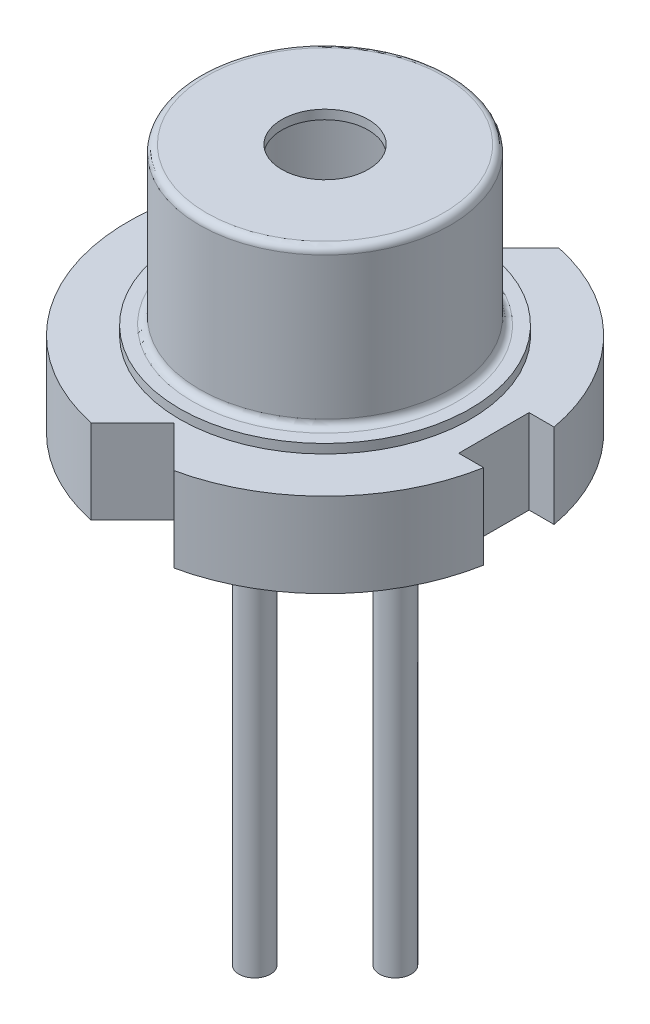
from build123d import *

# Parameters (mm, degrees)
SKETCH1_R           = 2.8
BOSS_EXTRUDE1_DEPTH = 1.2
SKETCH2_R           = 2.065
BOSS_EXTRUDE2_DEPTH = 0.13
SKETCH3_R           = 1.785
BOSS_EXTRUDE3_DEPTH = 2.22
SKETCH4_R           = 0.615
CUT_EXTRUDE1_DEPTH  = 1
SKETCH5_R           = 0.4
BOSS_EXTRUDE4_DEPTH = 0.05
SKETCH6_W           = 0.4
SKETCH6_H           = 1
CUT_EXTRUDE2_DEPTH  = 6.31812937
SKETCH7_R           = 0.6
BOSS_EXTRUDE5_DEPTH = 0.4
SKETCH8_R           = 0.225
BOSS_EXTRUDE6_DEPTH = 6
FILLET1_R           = 0.1
SKETCH9_R           = 1.655
CUT_EXTRUDE3_DEPTH  = 2.22


with BuildPart() as part:
    # Sketch1 → Boss-Extrude1 (new body)
    with BuildSketch(Plane(origin=(0, 0, 0), x_dir=(1, 0, 0), z_dir=(0, 1, 0))):
        with Locations(Location((0, 0, 0), (0, 0, 270))):
            Circle(SKETCH1_R)
    extrude(amount=BOSS_EXTRUDE1_DEPTH)

    # Sketch2 → Boss-Extrude2 (add)
    with BuildSketch(Plane(origin=(0, 1.2, 0), x_dir=(1, 0, 0), z_dir=(0, 1, 0))):
        with Locations(Location((0, 0, 0), (0, 0, 270))):
            Circle(SKETCH2_R)
    extrude(amount=BOSS_EXTRUDE2_DEPTH)

    # Sketch3 → Boss-Extrude3 (add)
    with BuildSketch(Plane(origin=(0, 1.33, 0), x_dir=(1, 0, 0), z_dir=(0, 1, 0))):
        with Locations(Location((0, 0, 0), (0, 0, 270))):
            Circle(SKETCH3_R)
    extrude(amount=BOSS_EXTRUDE3_DEPTH)

    # Sketch4 → Cut-Extrude1 (cut)
    with BuildSketch(Plane(origin=(0, 3.55, 0), x_dir=(1, 0, 0), z_dir=(0, 1, 0))):
        with Locations(Location((0, 0, 0), (0, 0, 270))):
            Circle(SKETCH4_R)
    extrude(amount=-CUT_EXTRUDE1_DEPTH, mode=Mode.SUBTRACT)

    # Sketch5 → Boss-Extrude4 (add)
    with BuildSketch(Plane.XZ):
        with Locations(Location((0, 1, 0), (0, 0, 90))):
            Circle(SKETCH5_R)
        with Locations(Location((0, -1, 0), (0, 0, 90))):
            Circle(SKETCH5_R)
    extrude(amount=BOSS_EXTRUDE4_DEPTH)

    # Sketch6 → Cut-Extrude2 (cut, through all)
    with BuildSketch(Plane.XZ):
        Polygon((0, 2.15), (0.65, 2.8), (-0.65, 2.8), align=None)
        with Locations((2.6, 0)):
            Rectangle(SKETCH6_W, SKETCH6_H)
        Polygon((0, -2.15), (-0.65, -2.8), (0.65, -2.8), align=None)
    extrude(amount=-CUT_EXTRUDE2_DEPTH, mode=Mode.SUBTRACT)

    # Sketch7 → Boss-Extrude5 (add)
    with BuildSketch(Plane.XZ):
        with Locations(Location((1, 0, 0), (0, 0, 90))):
            Circle(SKETCH7_R)
    extrude(amount=BOSS_EXTRUDE5_DEPTH)

    # Sketch8 → Boss-Extrude6 (add)
    with BuildSketch(Plane.XZ.offset(0.05)):
        with Locations(Location((0, 1, 0), (0, 0, 270))):
            Circle(SKETCH8_R)
        with Locations(Location((0, -1, 0), (0, 0, 270))):
            Circle(SKETCH8_R)
        with Locations(Location((1, 0, 0), (0, 0, 270))):
            Circle(SKETCH8_R)
    extrude(amount=BOSS_EXTRUDE6_DEPTH)

    # Fillet1
    fillet1_edges = [part.edges().sort_by_distance(p)[0] for p in [
        (0, 1.33, -1.785),
        (0, 3.55, -1.785),
    ]]
    fillet(fillet1_edges, radius=FILLET1_R)

    # Sketch9 → Cut-Extrude3 (cut)
    with BuildSketch(Plane(origin=(0, 1.2, 0), x_dir=(1, 0, 0), z_dir=(0, 1, 0))):
        with Locations(Location((0, 0, 0), (0, 0, 270))):
            Circle(SKETCH9_R)
    extrude(amount=CUT_EXTRUDE3_DEPTH, mode=Mode.SUBTRACT)


solid = part.part
